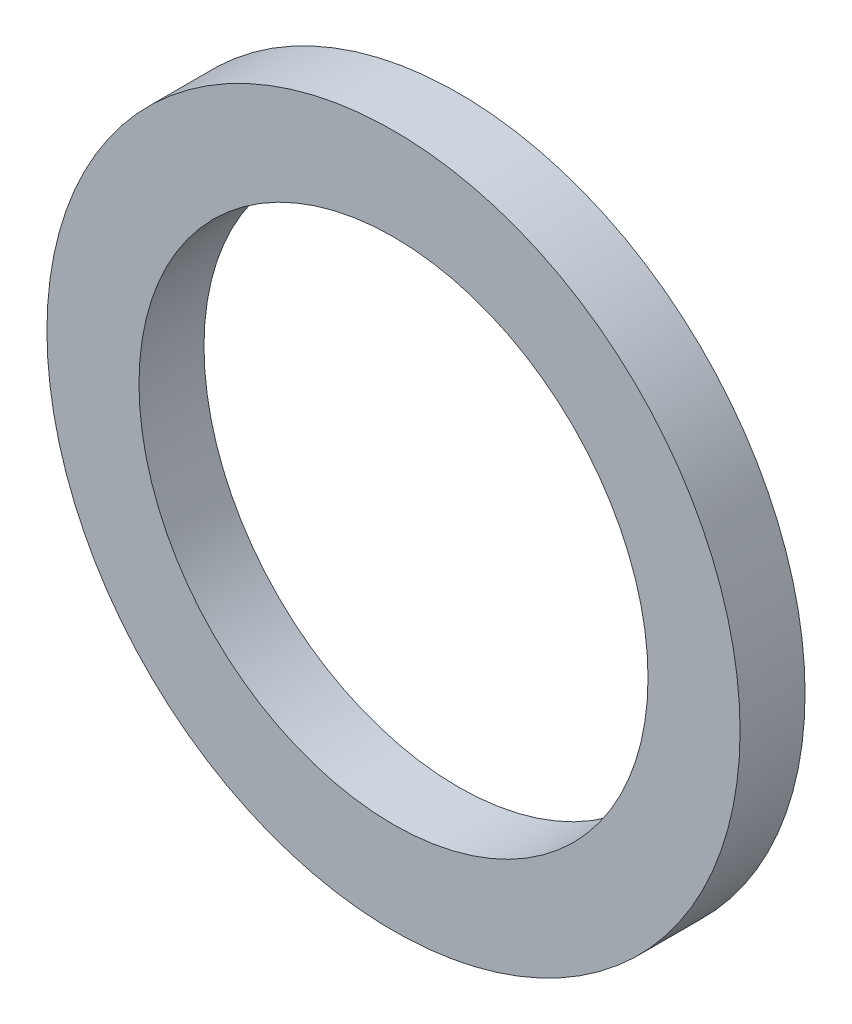
from build123d import *

# Parameters (mm, degrees)
SKETCH_1_R      = 3.2
SKETCH_1_R_2    = 2.35
EXTRUDE_1_DEPTH = 0.6


with BuildPart() as part:
    # 草图1 → 凸台-拉伸1 (new body)
    with BuildSketch(Plane.XY):
        Circle(SKETCH_1_R)
        Circle(SKETCH_1_R_2, mode=Mode.SUBTRACT)
    extrude(amount=EXTRUDE_1_DEPTH)


solid = part.part
